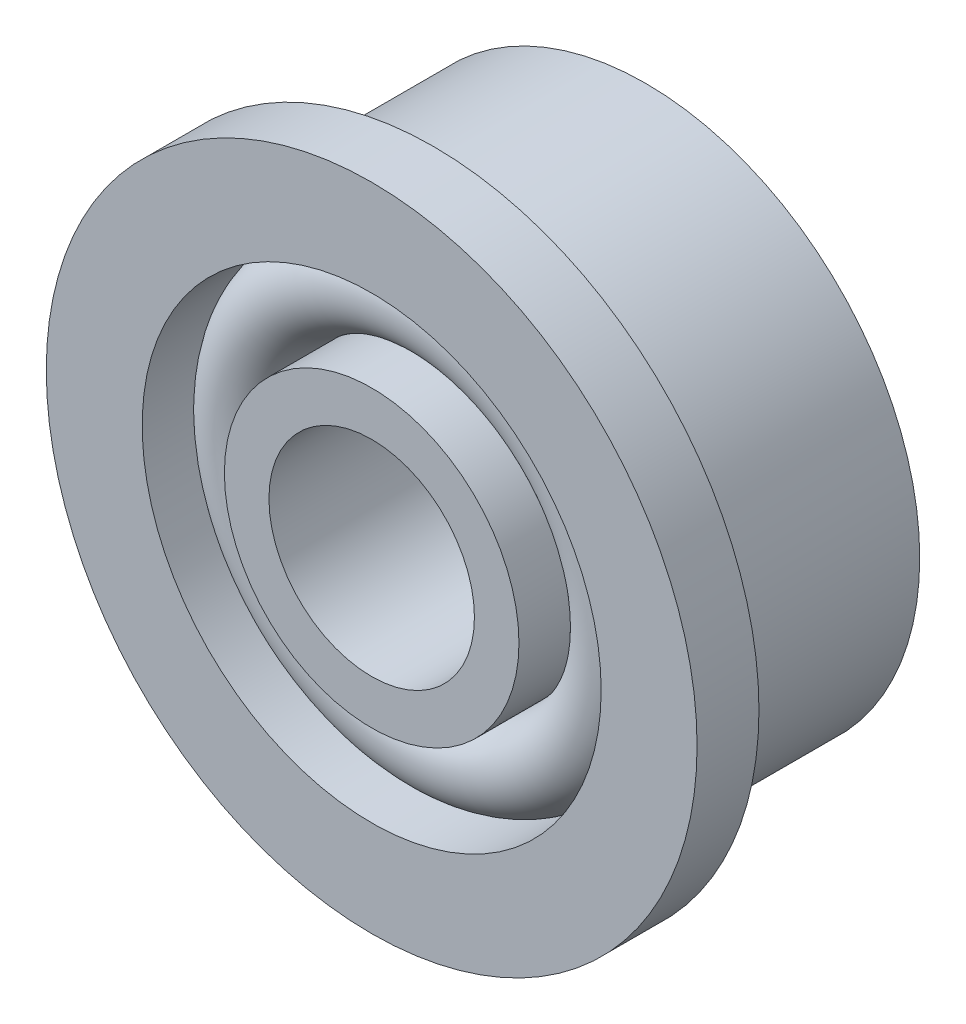
from build123d import *


with BuildPart() as part:
    # Esquisse1 → Révolution1 (revolve)
    with BuildSketch(Plane(origin=(0, 0, 0), x_dir=(0, 0, -1), z_dir=(1, 0, 0)), mode=Mode.PRIVATE) as r_volution1_sk:
        with BuildLine():
            Line((0, 1.5), (4, 1.5))
            Line((4, 1.5), (4, 2.15))
            Line((4, 2.15), (3, 2.15))
            ThreePointArc((3, 2.15), (3.6, 2.75), (3, 3.35))
            Line((3, 3.35), (4, 3.35))
            Line((4, 3.35), (4, 4))
            Line((4, 4), (0.903286234, 4))
            Line((0.903286234, 4), (0.903286234, 4.75))
            Line((0.903286234, 4.75), (0, 4.75))
            Line((0, 4.75), (0, 3.35))
            Line((0, 3.35), (1, 3.35))
            ThreePointArc((1, 3.35), (0.4, 2.75), (1, 2.15))
            Line((1, 2.15), (0, 2.15))
            Line((0, 2.15), (0, 1.5))
        make_face()
    revolve(r_volution1_sk.sketch.rotate(Axis((0, 0, 0), (0, 0, -1)), 90), axis=Axis((0, 0, 0), (0, 0, -1)))


solid = part.part
